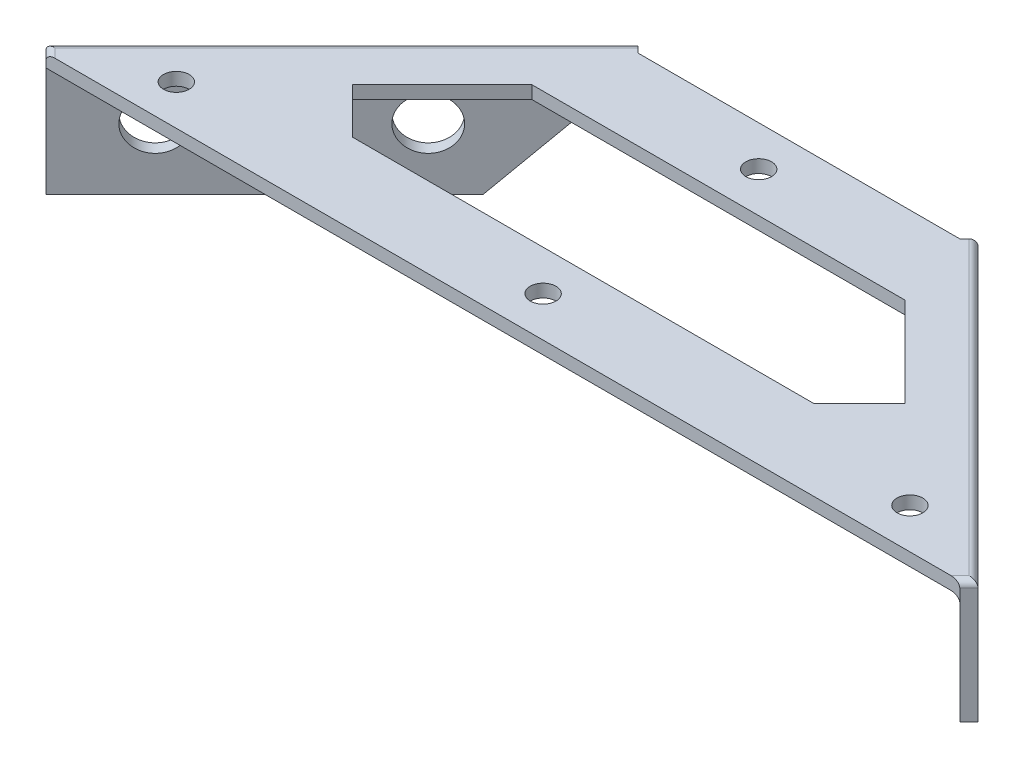
from build123d import *

# Parameters (mm, degrees)
BOSS_EXTRUDE1_DEPTH             = 2
BOSS_EXTRUDE2_DEPTH             = 17
BOSS_EXTRUDE2_DIRECTION_2_REACH = 86.623
SKETCH7_R                       = 4
CUT_EXTRUDE4_DEPTH              = 117.637747494
FILLET1_R                       = 1
CUT_EXTRUDE1_DEPTH              = 115.868304979
CUT_EXTRUDE2_DEPTH              = 89.209557156
SKETCH5_R                       = 2
CUT_EXTRUDE3_DEPTH              = 89.209557156


with BuildPart() as part:
    # Sketch1 → Boss-Extrude1 (new body)
    with BuildSketch(Plane(origin=(0, 0, 0), x_dir=(1, 0, 0), z_dir=(0, 1, 0))):
        Polygon((25, 46), (-25, 46), (-71, 0), (71, 0), align=None)
    extrude(amount=BOSS_EXTRUDE1_DEPTH)

    # Sketch2 → Boss-Extrude2 (add)
    with BuildSketch(Plane(origin=(0, 0, 0), x_dir=(-1, 0, 0), z_dir=(0, -1, 0))):
        Polygon((25, 46), (71, 0), (72.414213562, 1.414213562), (26.414213562, 47.414213562), align=None)
        Polygon((-26.414213562, 47.414213562), (-72.414213562, 1.414213562), (-71, 0), (-25, 46), align=None)
    extrude(amount=BOSS_EXTRUDE2_DEPTH)

    # Boss-Extrude2 direction 2: up to this face of the body (flat: up to its plane)
    boss_extrude2_direction_2_end = Plane(part.part.faces().sort_by_distance((0, 2, -19.326388889))[0])
    # Sketch2 → Boss-Extrude2 direction 2 (add, up to the picked face)
    with BuildSketch(Plane(origin=(0, 0, 0), x_dir=(-1, 0, 0), z_dir=(0, -1, 0)), mode=Mode.PRIVATE) as boss_extrude2_direction_2_sk1:
        Polygon((25, 46), (71, 0), (72.414213562, 1.414213562), (26.414213562, 47.414213562), align=None)
    boss_extrude2_direction_2_tool1 = split(extrude(boss_extrude2_direction_2_sk1.sketch, amount=-BOSS_EXTRUDE2_DIRECTION_2_REACH, mode=Mode.PRIVATE), bisect_by=boss_extrude2_direction_2_end, keep=Keep.BOTH, mode=Mode.PRIVATE)
    # Sketch2 → Boss-Extrude2 direction 2 (add, up to the picked face)
    with BuildSketch(Plane(origin=(0, 0, 0), x_dir=(-1, 0, 0), z_dir=(0, -1, 0)), mode=Mode.PRIVATE) as boss_extrude2_direction_2_sk2:
        Polygon((-26.414213562, 47.414213562), (-72.414213562, 1.414213562), (-71, 0), (-25, 46), align=None)
    boss_extrude2_direction_2_tool2 = split(extrude(boss_extrude2_direction_2_sk2.sketch, amount=-BOSS_EXTRUDE2_DIRECTION_2_REACH, mode=Mode.PRIVATE), bisect_by=boss_extrude2_direction_2_end, keep=Keep.BOTH, mode=Mode.PRIVATE)
    add(boss_extrude2_direction_2_tool1.solids().sort_by(Axis((-48.707107, 0, -23.707107), (0, 1, 0)))[0])
    add(boss_extrude2_direction_2_tool2.solids().sort_by(Axis((48.707107, 0, -23.707107), (0, 1, 0)))[0])

    # Sketch7 → Cut-Extrude4 (cut, through all)
    with BuildSketch(Plane(origin=(-36.914213562, 0, -36.914213562), x_dir=(-0.7071067811865512, 0, 0.7071067811865438), z_dir=(-0.7071067811865438, 0, -0.7071067811865512))):
        with Locations((38.204581464, -7.5)):
            Circle(SKETCH7_R)
        with Locations((8.204581464, -7.5)):
            Circle(SKETCH7_R)
    cut_extrude4 = extrude(amount=-CUT_EXTRUDE4_DEPTH, mode=Mode.SUBTRACT)

    # Fillet1
    fillet1_edges = [part.edges().sort_by_distance(p)[0] for p in [
        (-49.414213562, 2, -24.414213562),
        (-71.707106781, 2, -0.707106781),
        (71.707106781, 2, -0.707106781),
        (49.414213562, 2, -24.414213562),
        (48, 0, -23),
    ]]
    fillet(fillet1_edges, radius=FILLET1_R)

    # Sketch3 → Cut-Extrude1 (cut, through all)
    with BuildSketch(Plane(origin=(-35.5, 0, -35.5), x_dir=(0.7071067811865511, 0, -0.707106781186544), z_dir=(0.707106781186544, 0, 0.7071067811865511))):
        Polygon((14.849242405, 0), (-2.150757595, -17), (14.849242405, -17), align=None)
    cut_extrude1 = extrude(amount=-CUT_EXTRUDE1_DEPTH, mode=Mode.SUBTRACT)

    # Sketch4 → Cut-Extrude2 (cut, through all)
    with BuildSketch(Plane(origin=(0, 0, 0), x_dir=(-1, 0, 0), z_dir=(0, -1, 0))):
        Polygon((42.943650814, 19.571067812), (29.014718626, 33.5), (0, 33.5), (0, 12.5), (35.872583002, 12.5), align=None)
        Polygon((0, 12.5), (0, 33.5), (-29.014718626, 33.5), (-42.943650814, 19.571067812), (-35.872583002, 12.5), align=None)
    extrude(amount=-CUT_EXTRUDE2_DEPTH, mode=Mode.SUBTRACT)

    # Mirror1: Cut-Extrude4, Cut-Extrude1 across plane
    add(cut_extrude4.mirror(Plane.ZY), mode=Mode.SUBTRACT)
    add(cut_extrude1.mirror(Plane.ZY), mode=Mode.SUBTRACT)

    # Sketch5 → Cut-Extrude3 (cut, through all)
    with BuildSketch(Plane(origin=(0, 0, 0), x_dir=(-1, 0, 0), z_dir=(0, -1, 0))):
        with Locations(Location((0, 6.25, 0), (0, 0, 90))):
            Circle(SKETCH5_R)
        with Locations(Location((0, 39.75, 0), (0, 0, 90))):
            Circle(SKETCH5_R)
        with Locations(Location((-57, 6.25, 0), (0, 0, 90))):
            Circle(SKETCH5_R)
        with Locations(Location((57, 6.25, 0), (0, 0, 270))):
            Circle(SKETCH5_R)
    extrude(amount=-CUT_EXTRUDE3_DEPTH, mode=Mode.SUBTRACT)


solid = part.part
